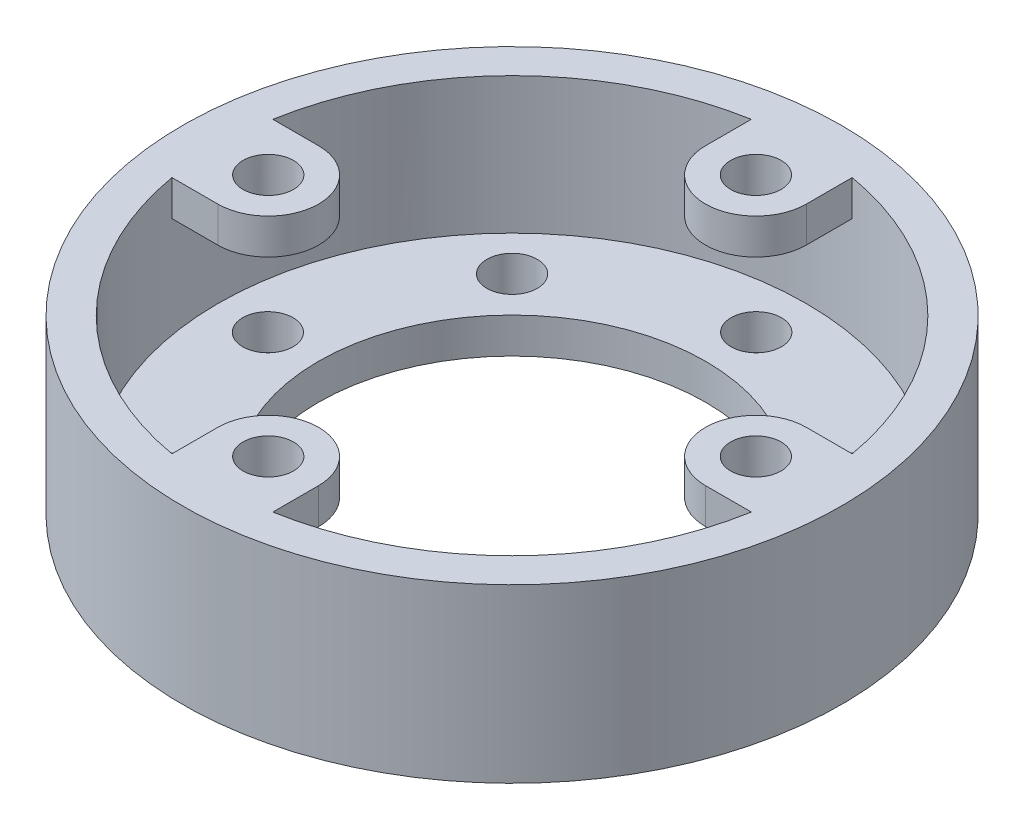
from build123d import *

# Parameters (mm, degrees)
SKETCH2_R           = 220
CUT_EXTRUDE1_DEPTH  = 4237.431281161
CIRPATTERN1_COUNT   = 8
BOSS_EXTRUDE1_START = -310
BOSS_EXTRUDE1_DEPTH = 310
CUT_EXTRUDE2_REACH  = 4335.734
SKETCH9_R           = 220
CIRPATTERN2_COUNT   = 4


with BuildPart() as part:
    # Sketch1 → Revolve1 (revolve)
    with BuildSketch(Plane.XY, mode=Mode.PRIVATE) as revolve1_sk:
        Polygon((1690, 0), (2875, 0), (2875, 1500), (2565, 1500), (2565, 310), (1690, 310), align=None)
    revolve(revolve1_sk.sketch.rotate(Axis((0, 0, 0), (0, 1, 0)), 90), axis=Axis((0, 0, 0), (0, 1, 0)))

    # Sketch2 → Cut-Extrude1 (cut, through all)
    with BuildSketch(Plane(origin=(0, 310, 0), x_dir=(1, 0, 0), z_dir=(0, 1, 0))):
        with Locations(Location((2130, 0, 0), (0, 0, 270))):
            Circle(SKETCH2_R)
    cut_extrude1 = extrude(amount=-CUT_EXTRUDE1_DEPTH, mode=Mode.SUBTRACT)

    # CirPattern1: Cut-Extrude1 ×8 about axis
    cirpattern1_axis = Axis((0, 0, 0), (0, 1, 0))
    for i in range(1, CIRPATTERN1_COUNT):
        add(cut_extrude1.rotate(cirpattern1_axis, i * 360 / CIRPATTERN1_COUNT), mode=Mode.SUBTRACT)

    # Sketch8 → Boss-Extrude1 (add)
    with BuildSketch(Plane(origin=(0, 1500, 0), x_dir=(1, 0, 0), z_dir=(0, 1, 0)).offset(BOSS_EXTRUDE1_START)):
        with BuildLine():
            Line((-440, 2526.979422156), (-440, 2126.979422156))
            ThreePointArc((-440, 2126.979422156), (0, 1686.979422156), (440, 2126.979422156))
            Line((440, 2126.979422156), (440, 2526.979422156))
            ThreePointArc((440, 2526.979422156), (0, 2565), (-440, 2526.979422156))
        make_face()
    boss_extrude1 = extrude(amount=BOSS_EXTRUDE1_DEPTH)

    # Sketch9 → Cut-Extrude2 (cut, up to next)
    with BuildSketch(Plane(origin=(0, 1500, 0), x_dir=(1, 0, 0), z_dir=(0, 1, 0)), mode=Mode.PRIVATE) as cut_extrude2_sk1:
        with Locations(Location((0, 2126.979422156, 0), (0, 0, 270))):
            Circle(SKETCH9_R)
    cut_extrude2_tool1 = extrude(cut_extrude2_sk1.sketch, amount=-CUT_EXTRUDE2_REACH, mode=Mode.PRIVATE) & part.part
    cut_extrude2 = cut_extrude2_tool1.solids().sort_by_distance((0, 1500, -2126.979422))[0]
    add(cut_extrude2, mode=Mode.SUBTRACT)

    # CirPattern2: Boss-Extrude1, Cut-Extrude2 ×4 about axis
    cirpattern2_axis = Axis((0, 0, 0), (0, 1, 0))
    add([boss_extrude1.rotate(cirpattern2_axis, i * 360 / CIRPATTERN2_COUNT) for i in range(1, CIRPATTERN2_COUNT)])
    add([cut_extrude2.rotate(cirpattern2_axis, i * 360 / CIRPATTERN2_COUNT) for i in range(1, CIRPATTERN2_COUNT)], mode=Mode.SUBTRACT)


solid = part.part
